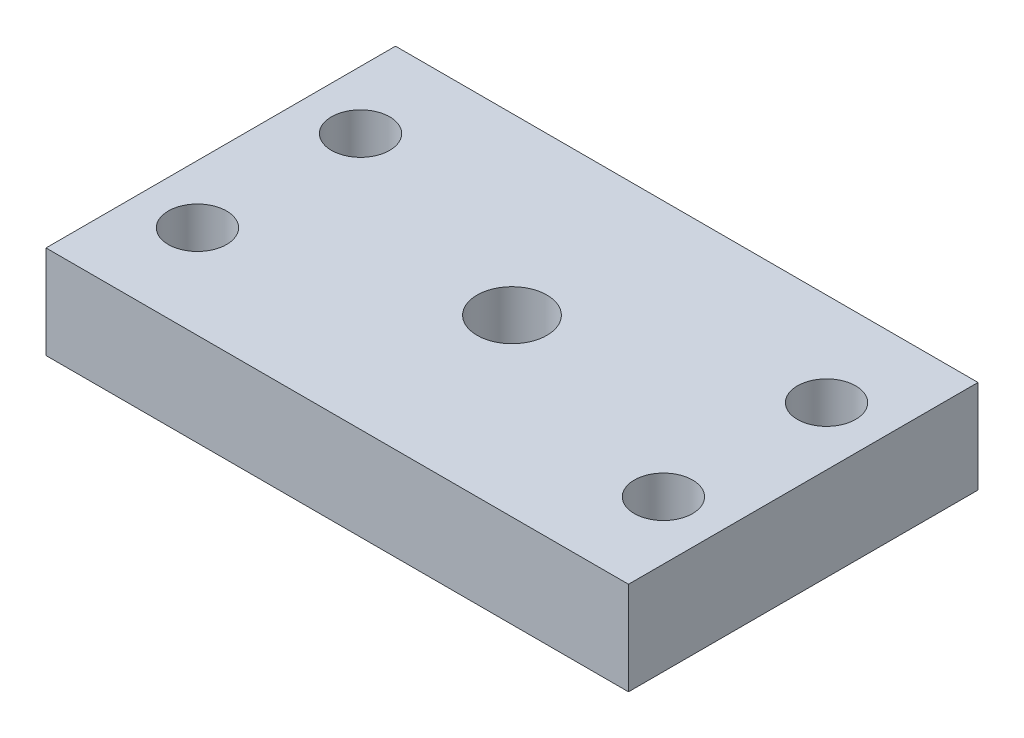
from build123d import *

# Parameters (mm, degrees)
SKETCH_1_W          = 25
SKETCH_1_H          = 15
EXTRUDE_1_DEPTH     = 4
SKETCH_2_R          = 1.25
SKETCH_2_R_2        = 1.5
CUT_EXTRUDE_1_DEPTH = 4


with BuildPart() as part:
    # 草图1 → 凸台-拉伸1 (new body)
    with BuildSketch(Plane(origin=(0, 0, 0), x_dir=(1, 0, 0), z_dir=(0, 1, 0))):
        with Locations((12.5, -7.5)):
            Rectangle(SKETCH_1_W, SKETCH_1_H)
    extrude(amount=EXTRUDE_1_DEPTH)

    # 草图2 → 切除-拉伸1 (cut)
    with BuildSketch(Plane(origin=(0, 4, 0), x_dir=(1, 0, 0), z_dir=(0, 1, 0))):
        with Locations(Location((2.5, -4, 0), (0, 0, 270))):
            Circle(SKETCH_2_R)
        with Locations(Location((2.5, -11, 0), (0, 0, 270))):
            Circle(SKETCH_2_R)
        with Locations(Location((22.5, -11, 0), (0, 0, 90))):
            Circle(SKETCH_2_R)
        with Locations(Location((22.5, -4, 0), (0, 0, 90))):
            Circle(SKETCH_2_R)
        with Locations(Location((12.5, -7.5, 0), (0, 0, 270))):
            Circle(SKETCH_2_R_2)
    extrude(amount=-CUT_EXTRUDE_1_DEPTH, mode=Mode.SUBTRACT)


solid = part.part
